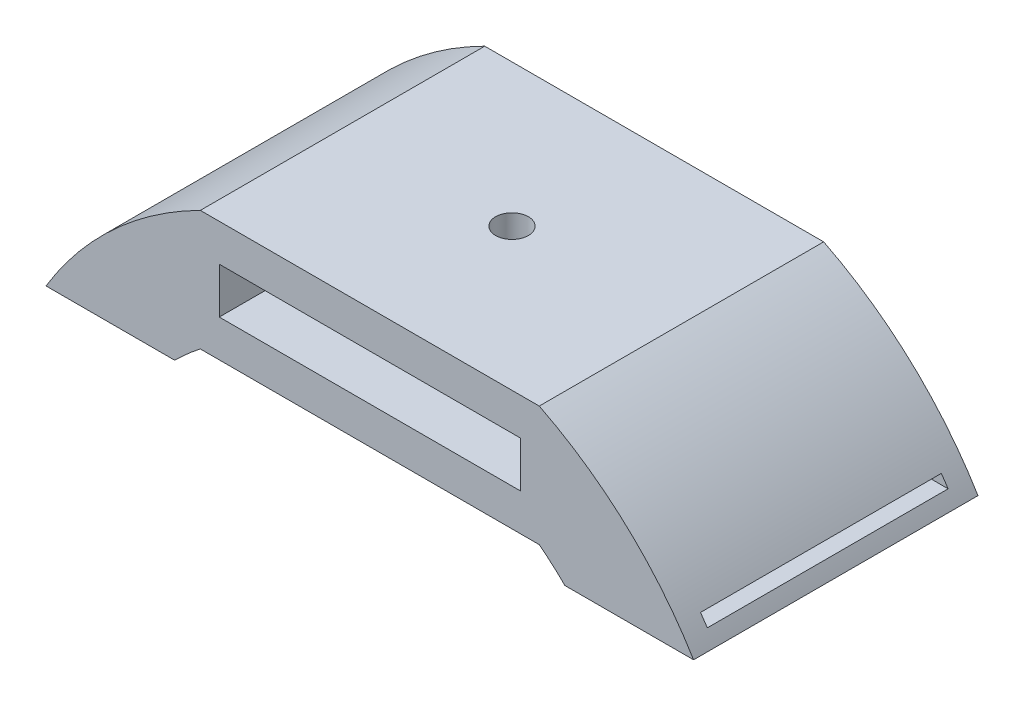
from build123d import *

# Parameters (mm, degrees)
BOSS_EXTRUDE1_DEPTH      = 8.83
BOSS_EXTRUDE1_DEPTH_BACK = 3.83
SKETCH1_W                = 35.75
SKETCH1_H                = 30
SKETCH1_R                = 1.725
SKETCH2_W                = 31.75
SKETCH2_H                = 4.83
CUT_EXTRUDE1_DEPTH       = 37.317668183
BOSS_EXTRUDE4_DEPTH      = 7.368601
BOSS_EXTRUDE4_DEPTH_BACK = 22.631399
SKETCH7_W                = 25.4
SKETCH7_H                = 1.05
CUT_EXTRUDE2_DEPTH       = 73.49839785
SKETCH8_R                = 2.85
CUT_EXTRUDE3_DEPTH       = 3


with BuildPart() as part:
    # Sketch1 → Boss-Extrude1 (new, two sides: drawn at the far end of the back side and taken through both)
    with BuildSketch(Plane(origin=(0, 0, 0), x_dir=(1, 0, 0), z_dir=(0, 1, 0)).offset(-BOSS_EXTRUDE1_DEPTH_BACK)):
        with Locations((-0.591296928, 7.631399317)):
            Rectangle(SKETCH1_W, SKETCH1_H)
        with Locations(Location((-0.591296928, 7.631399317, 0), (0, 0, 270))):
            Circle(SKETCH1_R, mode=Mode.SUBTRACT)
    extrude(amount=BOSS_EXTRUDE1_DEPTH + BOSS_EXTRUDE1_DEPTH_BACK)

    # Sketch2 → Cut-Extrude1 (cut, through all)
    with BuildSketch(Plane(origin=(0, 0, -22.631399317), x_dir=(-1, 0, 0), z_dir=(0, 0, -1))):
        with Locations((0.591296928, 2.5)):
            Rectangle(SKETCH2_W, SKETCH2_H)
    extrude(amount=-CUT_EXTRUDE1_DEPTH, mode=Mode.SUBTRACT)

    # Sketch4 → Boss-Extrude4 (add, two sides: drawn at the far end of the back side and taken through both)
    with BuildSketch(Plane.XY.offset(-BOSS_EXTRUDE4_DEPTH_BACK)):
        with BuildLine():
            Line((33.562284713, -6.212446851), (19.98770661, -6.212446851))
            ThreePointArc((19.98770661, -6.212446851), (18.67257107, -4.979381394), (17.283703072, -3.83))
            Line((17.283703072, -3.83), (17.283703072, 8.83))
            ThreePointArc((17.283703072, 8.83), (26.488439568, 2.461776787), (33.562284713, -6.212446851))
        make_face()
        with BuildLine():
            Line((-21.170300466, -6.212446851), (-34.74487857, -6.212446851))
            ThreePointArc((-34.74487857, -6.212446851), (-27.671033425, 2.461776787), (-18.466296928, 8.83))
            Line((-18.466296928, 8.83), (-18.466296928, -3.83))
            ThreePointArc((-18.466296928, -3.83), (-19.855164927, -4.979381394), (-21.170300466, -6.212446851))
        make_face()
    extrude(amount=BOSS_EXTRUDE4_DEPTH + BOSS_EXTRUDE4_DEPTH_BACK)

    # Sketch7 → Cut-Extrude2 (cut, through all)
    with BuildSketch(Plane.ZY.offset(34.74487857)):
        with Locations((-7.631399317, -4.340632565)):
            Rectangle(SKETCH7_W, SKETCH7_H)
    extrude(amount=-CUT_EXTRUDE2_DEPTH, mode=Mode.SUBTRACT)

    # Sketch8 → Cut-Extrude3 (cut)
    with BuildSketch(Plane.XZ.offset(3.83)):
        with Locations(Location((-0.591296928, -7.631399317, 0), (0, 0, 270))):
            Circle(SKETCH8_R)
    extrude(amount=-CUT_EXTRUDE3_DEPTH, mode=Mode.SUBTRACT)


solid = part.part
